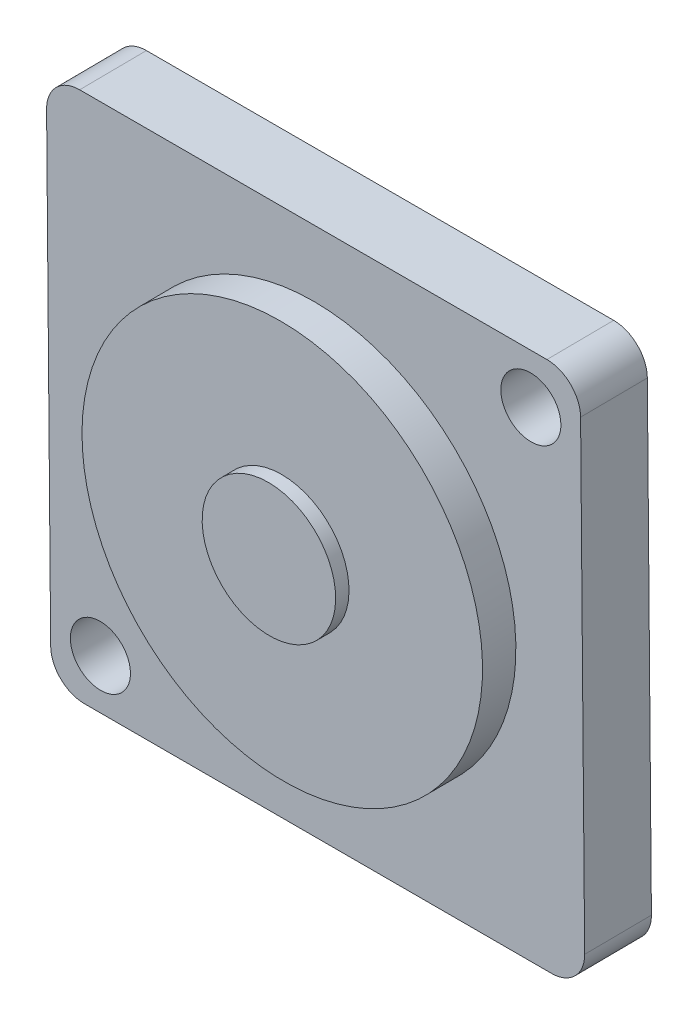
from build123d import *

# Parameters (mm, degrees)
BOSS_EXTRUDE2_DEPTH      = 4.999462447
BOSS_EXTRUDE2_DEPTH_BACK = 0.0001
SKETCH4_W                = 40
SKETCH4_H                = 40
SKETCH6_R                = 15
BOSS_EXTRUDE3_DEPTH      = 2.5
SKETCH7_R                = 5
BOSS_EXTRUDE4_DEPTH      = 1
SKETCH9_R                = 2.25
CUT_EXTRUDE1_DEPTH       = 5
SKETCH10_R               = 2.25
CUT_EXTRUDE2_DEPTH       = 5
FILLET2_R                = 2.5
BODY_MOVE_COPY2_ANGLE    = 90.001090824


with BuildPart() as part:
    # Sketch4 → Boss-Extrude2 (new, two sides: drawn at the far end of the back side and taken through both)
    with BuildSketch(Plane.XY.offset(-BOSS_EXTRUDE2_DEPTH_BACK)):
        Rectangle(SKETCH4_W, SKETCH4_H)
    extrude(amount=BOSS_EXTRUDE2_DEPTH + BOSS_EXTRUDE2_DEPTH_BACK)

    # Sketch6 → Boss-Extrude3 (add)
    with BuildSketch(Plane.XY.offset(4.999462447)):
        Circle(SKETCH6_R)
    extrude(amount=BOSS_EXTRUDE3_DEPTH)

    # Sketch7 → Boss-Extrude4 (add)
    with BuildSketch(Plane.XY.offset(7.499462447)):
        Circle(SKETCH7_R)
    extrude(amount=BOSS_EXTRUDE4_DEPTH)

    # Sketch9 → Cut-Extrude1 (cut)
    with BuildSketch(Plane.XY.offset(4.999462447)):
        with Locations((-16.263, 16.263)):
            Circle(SKETCH9_R)
    extrude(amount=-CUT_EXTRUDE1_DEPTH, mode=Mode.SUBTRACT)

    # Sketch10 → Cut-Extrude2 (cut)
    with BuildSketch(Plane.XY.offset(4.999462447)):
        with Locations((16.263, -16.263)):
            Circle(SKETCH10_R)
    extrude(amount=-CUT_EXTRUDE2_DEPTH, mode=Mode.SUBTRACT)

    # Fillet2
    fillet2_edges = [part.edges().sort_by_distance(p)[0] for p in [
        (20, -20, 2.499681224),
        (-20, -20, 2.499681224),
        (-20, 20, 2.499681224),
        (20, 20, 2.499681224),
    ]]
    fillet(fillet2_edges, radius=FILLET2_R)


with BuildPart() as part_1:
    # Body-Move/Copy2: moved
    add(part.part.moved(Location((0, 0, 0))).rotate(Axis((0.018337793, 0.018337793, 0.000160028), (0.004363267749989983, 0.004363267749984885, -0.9999809617133137)), BODY_MOVE_COPY2_ANGLE))


solid = part_1.part
